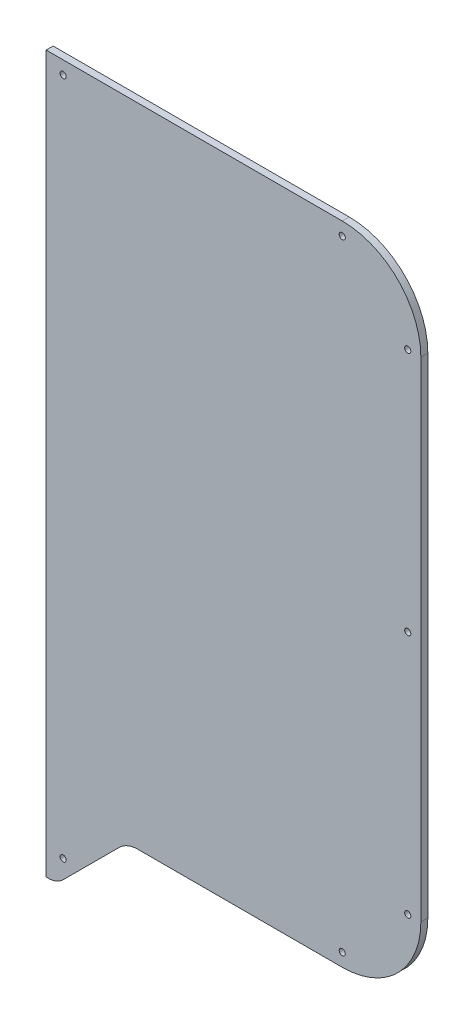
from build123d import *

# Parameters (mm, degrees)
SKETCH1_R           = 1.75
BOSS_EXTRUDE1_DEPTH = 4


with BuildPart() as part:
    # Sketch1 → Boss-Extrude1 (new body)
    with BuildSketch(Plane.XY):
        with BuildLine():
            Line((2024.321699886, -20.389970185), (2025.564078039, -20.389970185))
            ThreePointArc((2025.564078039, -20.389970185), (2030.155451072, -19.476867572), (2034.048091653, -16.876519131))
            Line((2034.048091653, -16.876519131), (2066.152417854, 15.218215997))
            ThreePointArc((2066.152417854, 15.218215997), (2071.01821858, 18.468651549), (2076.757434871, 19.610029815))
            Line((2076.757434871, 19.610029815), (2193.821699886, 19.610029815))
            ThreePointArc((2193.821699886, 19.610029815), (2225.64150504, 32.790224661), (2238.821699886, 64.610029815))
            Line((2238.821699886, 64.610029815), (2238.821699886, 344.610029815))
            ThreePointArc((2238.821699886, 344.610029815), (2225.64150504, 376.429834968), (2193.821699886, 389.610029815))
            Line((2193.821699886, 389.610029815), (2024.321699886, 389.610029815))
            Line((2024.321699886, 389.610029815), (2024.321699886, -20.389970185))
        make_face()
        with Locations((2034.048091653, -6.27150164)):
            Circle(SKETCH1_R, mode=Mode.SUBTRACT)
        with Locations((2193.821699886, 27.110029815)):
            Circle(SKETCH1_R, mode=Mode.SUBTRACT)
        with Locations((2231.321699886, 64.610029815)):
            Circle(SKETCH1_R, mode=Mode.SUBTRACT)
        with Locations((2231.321699886, 204.610029815)):
            Circle(SKETCH1_R, mode=Mode.SUBTRACT)
        with Locations((2231.321699886, 344.610029815)):
            Circle(SKETCH1_R, mode=Mode.SUBTRACT)
        with Locations((2193.821699886, 382.110029815)):
            Circle(SKETCH1_R, mode=Mode.SUBTRACT)
        with Locations((2034.048091653, 382.110029815)):
            Circle(SKETCH1_R, mode=Mode.SUBTRACT)
    extrude(amount=BOSS_EXTRUDE1_DEPTH)


solid = part.part
